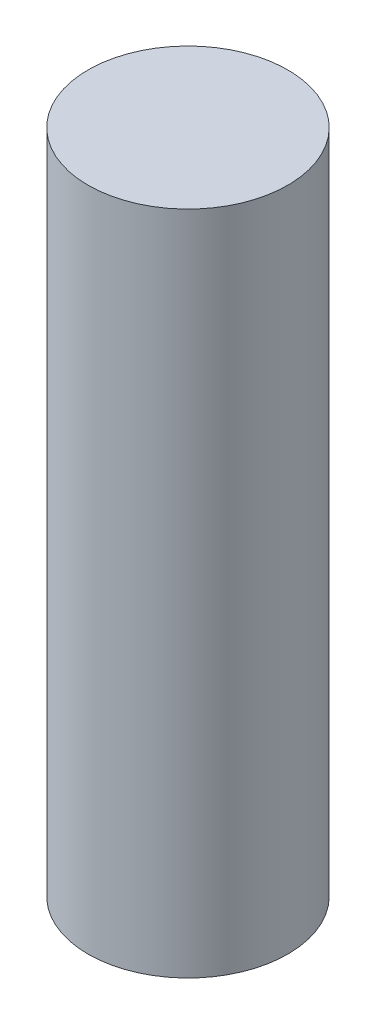
from build123d import *

# Parameters (mm, degrees)
ESBO_O1_R                = 15
RESSALTO_EXTRUS_O1_DEPTH = 100


with BuildPart() as part:
    # Esboço1 → Ressalto-extrusão1 (new body)
    with BuildSketch(Plane(origin=(0, 0, 0), x_dir=(1, 0, 0), z_dir=(0, 1, 0))):
        with Locations(Location((0, 0, 0), (0, 0, 270))):
            Circle(ESBO_O1_R)
    extrude(amount=RESSALTO_EXTRUS_O1_DEPTH)


solid = part.part
